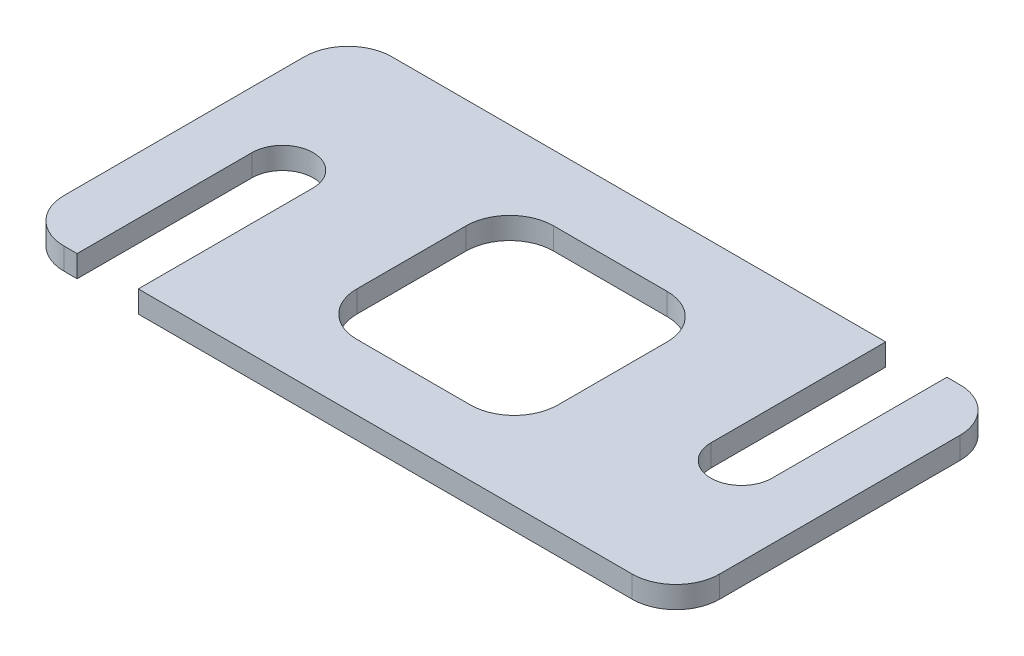
from build123d import *

# Parameters (mm, degrees)
SKETCH2_W               = 150
SKETCH2_H               = 75
BOSS_EXTRUDE1_DEPTH     = 5
CUT_EXTRUDE1_DEPTH      = 168.779617356
CUT_EXTRUDE1_DEPTH_BACK = 168.779617356
SKETCH4_W               = 46
SKETCH4_H               = 45
CUT_EXTRUDE2_DEPTH      = 168.779617356
FILLET1_R               = 10
FILLET2_R               = 10


with BuildPart() as part:
    # Sketch2 → Boss-Extrude1 (new body)
    with BuildSketch(Plane(origin=(0, 0, 0), x_dir=(1, 0, 0), z_dir=(0, 1, 0))):
        with Locations((75, 37.5)):
            Rectangle(SKETCH2_W, SKETCH2_H)
    extrude(amount=BOSS_EXTRUDE1_DEPTH)

    # Sketch3 → Cut-Extrude1 (cut, two sides: drawn at the far end of the back side and taken through both)
    with BuildSketch(Plane(origin=(0, 5, 0), x_dir=(1, 0, 0), z_dir=(0, 1, 0)).offset(-CUT_EXTRUDE1_DEPTH_BACK)):
        with BuildLine():
            Line((13, 0), (13, 40))
            ThreePointArc((13, 40), (20, 47), (27, 40))
            Line((27, 40), (27, 0))
            Line((27, 0), (13, 0))
        make_face()
        with BuildLine():
            Line((137, 75), (137, 35))
            ThreePointArc((137, 35), (130, 28), (123, 35))
            Line((123, 35), (123, 75))
            Line((123, 75), (137, 75))
        make_face()
    extrude(amount=CUT_EXTRUDE1_DEPTH + CUT_EXTRUDE1_DEPTH_BACK, mode=Mode.SUBTRACT)

    # Sketch4 → Cut-Extrude2 (cut, through all)
    with BuildSketch(Plane(origin=(0, 5, 0), x_dir=(1, 0, 0), z_dir=(0, 1, 0))):
        with Locations((75, 37.5)):
            Rectangle(SKETCH4_W, SKETCH4_H)
    extrude(amount=-CUT_EXTRUDE2_DEPTH, mode=Mode.SUBTRACT)

    # Fillet1
    fillet1_edges = [part.edges().sort_by_distance(p)[0] for p in [
        (0, 2.5, 0),
        (0, 2.5, -75),
        (150, 2.5, -75),
        (150, 2.5, 0),
    ]]
    fillet(fillet1_edges, radius=FILLET1_R)

    # Fillet2
    fillet2_edges = [part.edges().sort_by_distance(p)[0] for p in [
        (52, 2.5, -15),
        (52, 2.5, -60),
        (98, 2.5, -60),
        (98, 2.5, -15),
    ]]
    fillet(fillet2_edges, radius=FILLET2_R)


solid = part.part
